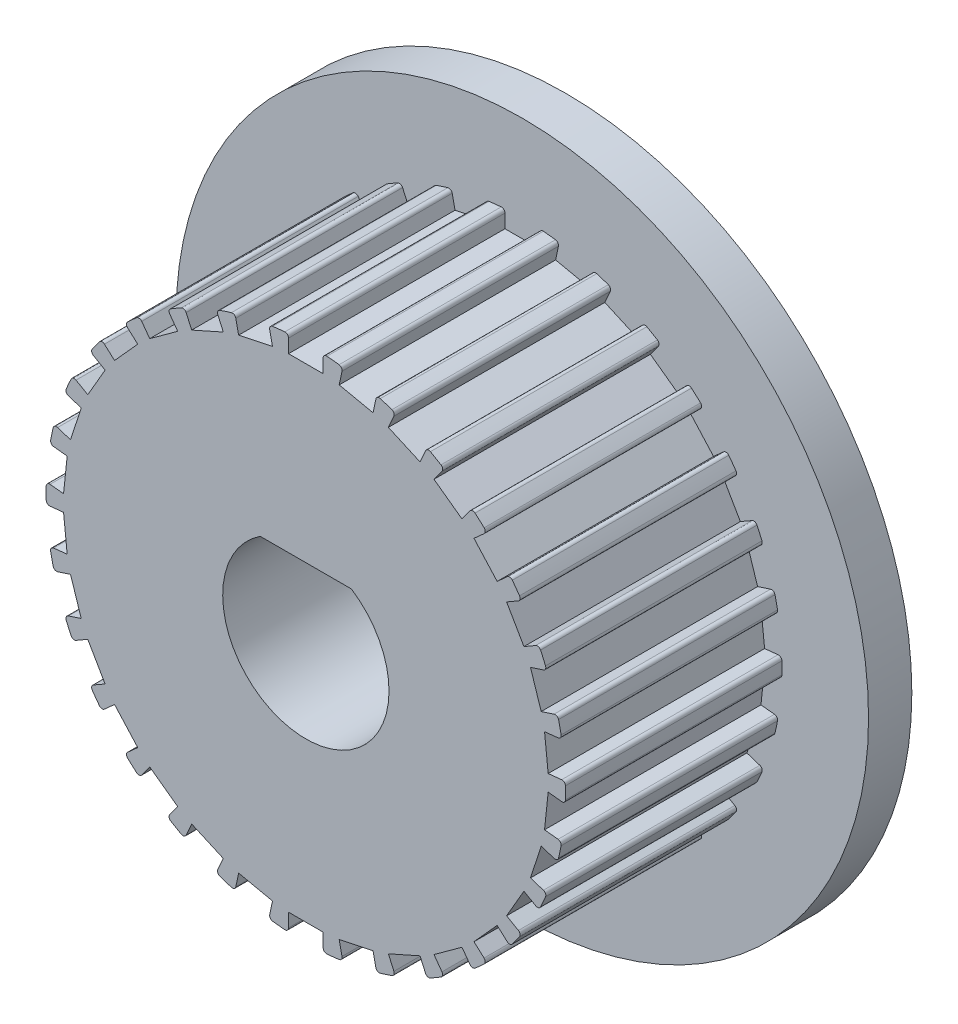
from build123d import *

# Parameters (mm, degrees)
SKETCH1_R                = 12.7
BOSS_EXTRUDE1_DEPTH      = 1.5875
SKETCH2_R                = 9.525
BOSS_EXTRUDE2_DEPTH      = 7.9375
SKETCH3_R                = 3.05
CUT_EXTRUDE1_DEPTH       = 21.329919454
SKETCH4_W                = 1.27
SKETCH4_H                = 0.635
CUT_EXTRUDE2_DEPTH       = 7.9375
FILLET2_R                = 0.127
CIRPATTERN1_COUNT        = 30
FILLET2_OF_CIRPATTERN1_R = 0.127
BOSS_EXTRUDE3_DEPTH      = 9.525


with BuildPart() as part:
    # Sketch1 → Boss-Extrude1 (new body)
    with BuildSketch(Plane.XY):
        Circle(SKETCH1_R)
    extrude(amount=BOSS_EXTRUDE1_DEPTH)

    # Sketch2 → Boss-Extrude2 (add)
    with BuildSketch(Plane.XY.offset(1.5875)):
        Circle(SKETCH2_R)
    extrude(amount=BOSS_EXTRUDE2_DEPTH)

    # Sketch3 → Cut-Extrude1 (cut, through all)
    with BuildSketch(Plane.XY.offset(9.525)):
        Circle(SKETCH3_R)
    extrude(amount=-CUT_EXTRUDE1_DEPTH, mode=Mode.SUBTRACT)

    # Sketch4 → Cut-Extrude2 (cut)
    with BuildSketch(Plane.XY.offset(9.525)):
        with Locations((0, 9.821309762)):
            Rectangle(SKETCH4_W, SKETCH4_H)
        with Locations((0, 9.186309762)):
            Rectangle(SKETCH4_W, SKETCH4_H)
    cut_extrude2 = extrude(amount=-CUT_EXTRUDE2_DEPTH, mode=Mode.SUBTRACT)

    # Fillet2
    fillet2_edges = [part.edges().sort_by_distance(p)[0] for p in [
        (-0.635, 9.503809762, 5.55625),
        (0.635, 9.503809762, 5.55625),
    ]]
    fillet(fillet2_edges, radius=FILLET2_R)

    # CirPattern1: Cut-Extrude2 ×30 about axis
    cirpattern1_axis = Axis((0, 0, 0), (0, 0, 1))
    for i in range(1, CIRPATTERN1_COUNT):
        add(cut_extrude2.rotate(cirpattern1_axis, i * 360 / CIRPATTERN1_COUNT), mode=Mode.SUBTRACT)

    # Fillet2 of CirPattern1
    fillet2_of_cirpattern1_edges = [part.edges().sort_by_distance(p)[0] for p in [
        (-2.597076883, 9.164104793, 5.55625),
        (-1.35482943, 9.428152641, 5.55625),
        (-4.445649045, 8.42388447, 5.55625),
        (-3.285446314, 8.940440007, 5.55625),
        (-6.09992501, 7.315499974, 5.55625),
        (-5.072473428, 8.061987244, 5.55625),
        (-7.487604982, 5.887393025, 5.55625),
        (-6.637809112, 6.831186953, 5.55625),
        (-8.548040687, 4.20197875, 5.55625),
        (-7.913040687, 5.301831013, 5.55625),
        (-9.234885996, 2.33291784, 5.55625),
        (-8.842434413, 3.540759616, 5.55625),
        (-9.518122472, 0.361897226, 5.55625),
        (-9.385371324, 1.624940033, 5.55625),
        (-9.385371324, -1.624940033, 5.55625),
        (-9.518122472, -0.361897226, 5.55625),
        (-8.842434413, -3.540759616, 5.55625),
        (-9.234885996, -2.33291784, 5.55625),
        (-7.913040687, -5.301831013, 5.55625),
        (-8.548040687, -4.20197875, 5.55625),
        (-6.637809112, -6.831186953, 5.55625),
        (-7.487604982, -5.887393025, 5.55625),
        (-5.072473428, -8.061987244, 5.55625),
        (-6.09992501, -7.315499974, 5.55625),
        (-3.285446314, -8.940440007, 5.55625),
        (-4.445649045, -8.42388447, 5.55625),
        (-1.35482943, -9.428152641, 5.55625),
        (-2.597076883, -9.164104793, 5.55625),
        (0.635, -9.503809762, 5.55625),
        (-0.635, -9.503809762, 5.55625),
        (2.597076883, -9.164104793, 5.55625),
        (1.35482943, -9.428152641, 5.55625),
        (4.445649045, -8.42388447, 5.55625),
        (3.285446314, -8.940440007, 5.55625),
        (6.09992501, -7.315499974, 5.55625),
        (5.072473428, -8.061987244, 5.55625),
        (7.487604982, -5.887393025, 5.55625),
        (6.637809112, -6.831186953, 5.55625),
        (8.548040687, -4.20197875, 5.55625),
        (7.913040687, -5.301831013, 5.55625),
        (9.234885996, -2.33291784, 5.55625),
        (8.842434413, -3.540759616, 5.55625),
        (9.518122472, -0.361897226, 5.55625),
        (9.385371324, -1.624940033, 5.55625),
        (9.385371324, 1.624940033, 5.55625),
        (9.518122472, 0.361897226, 5.55625),
        (8.842434413, 3.540759616, 5.55625),
        (9.234885996, 2.33291784, 5.55625),
        (7.913040687, 5.301831013, 5.55625),
        (8.548040687, 4.20197875, 5.55625),
        (6.637809112, 6.831186953, 5.55625),
        (7.487604982, 5.887393025, 5.55625),
        (5.072473428, 8.061987244, 5.55625),
        (6.09992501, 7.315499974, 5.55625),
        (3.285446314, 8.940440007, 5.55625),
        (4.445649045, 8.42388447, 5.55625),
        (1.35482943, 9.428152641, 5.55625),
        (2.597076883, 9.164104793, 5.55625),
    ]]
    fillet(fillet2_of_cirpattern1_edges, radius=FILLET2_OF_CIRPATTERN1_R)

    # Sketch5 → Boss-Extrude3 (add, through all)
    with BuildSketch(Plane(origin=(0, 0, 0), x_dir=(-1, 0, 0), z_dir=(0, 0, -1))):
        with BuildLine():
            Line((-1.673320053, 2.55), (1.673320053, 2.55))
            ThreePointArc((1.673320053, 2.55), (0, 3.05), (-1.673320053, 2.55))
        make_face()
    extrude(amount=-BOSS_EXTRUDE3_DEPTH)


solid = part.part
